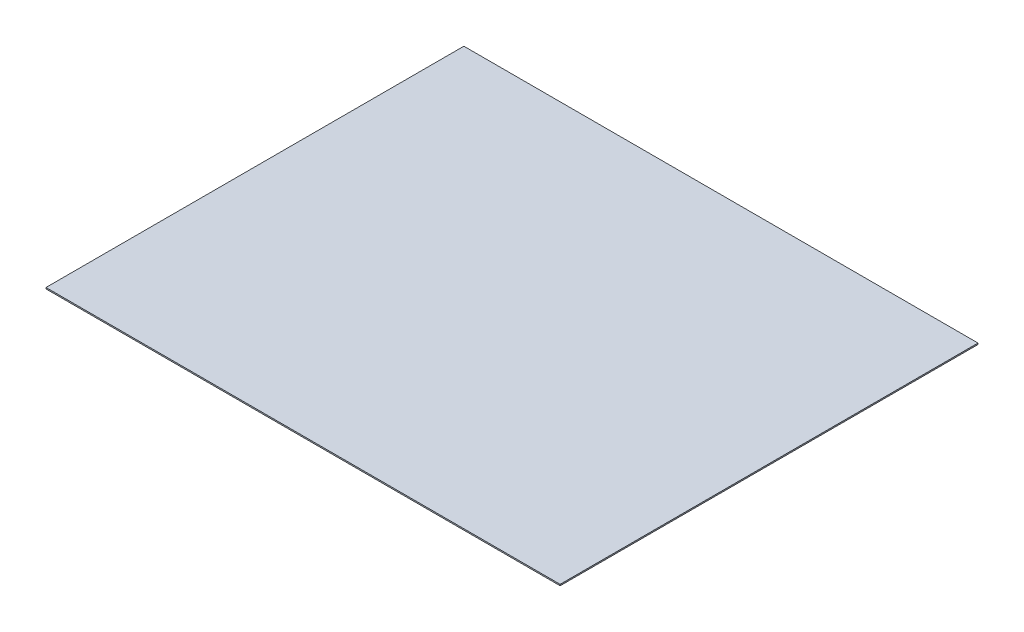
from build123d import *

# Parameters (mm, degrees)
SKETCH1_W           = 625.602
SKETCH1_H           = 508.46228
BOSS_EXTRUDE1_DEPTH = 1.5875


with BuildPart() as part:
    # Sketch1 → Boss-Extrude1 (new body)
    with BuildSketch(Plane(origin=(0, 0, 0), x_dir=(1, 0, 0), z_dir=(0, 1, 0))):
        with Locations((312.801, 254.23114)):
            Rectangle(SKETCH1_W, SKETCH1_H)
    extrude(amount=BOSS_EXTRUDE1_DEPTH)


solid = part.part
